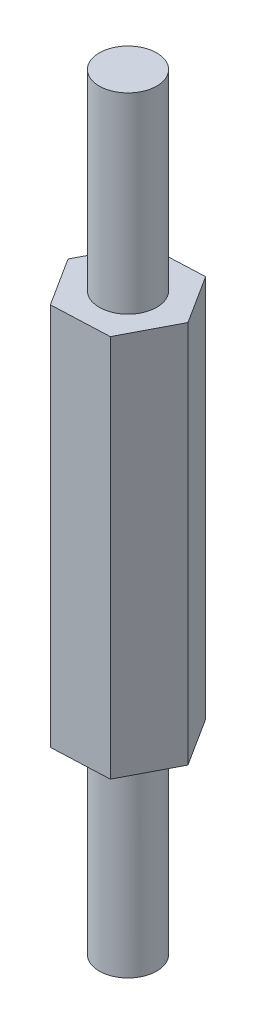
from build123d import *

# Parameters (mm, degrees)
BOSS_EXTRUDE1_DEPTH = 20
SKETCH4_R           = 1.5
BOSS_EXTRUDE2_DEPTH = 10
BOSS_EXTRUDE3_START = 10
SKETCH5_R           = 1.5
BOSS_EXTRUDE3_DEPTH = 10


with BuildPart() as part:
    # Sketch3 → Boss-Extrude1 (new body)
    with BuildSketch(Plane(origin=(0, 0, 0), x_dir=(1, 0, 0), z_dir=(0, 1, 0))):
        Polygon((1.388964752, 2.662182442), (-1.611035248, 2.533969981), (-3, -0.12821246), (-1.388964752, -2.662182442), (1.611035248, -2.533969981), (3, 0.12821246), align=None)
    extrude(amount=BOSS_EXTRUDE1_DEPTH)

    # Sketch4 → Boss-Extrude2 (add)
    with BuildSketch(Plane(origin=(0, 20, 0), x_dir=(1, 0, 0), z_dir=(0, 1, 0))):
        with Locations(Location((0, 0, 0), (0, 0, 270))):
            Circle(SKETCH4_R)
    extrude(amount=BOSS_EXTRUDE2_DEPTH)

    # Sketch5 → Boss-Extrude3 (add)
    with BuildSketch(Plane.XZ.offset(BOSS_EXTRUDE3_START)):
        with Locations(Location((0, 0, 0), (0, 0, 90))):
            Circle(SKETCH5_R)
    extrude(amount=-BOSS_EXTRUDE3_DEPTH)


solid = part.part
